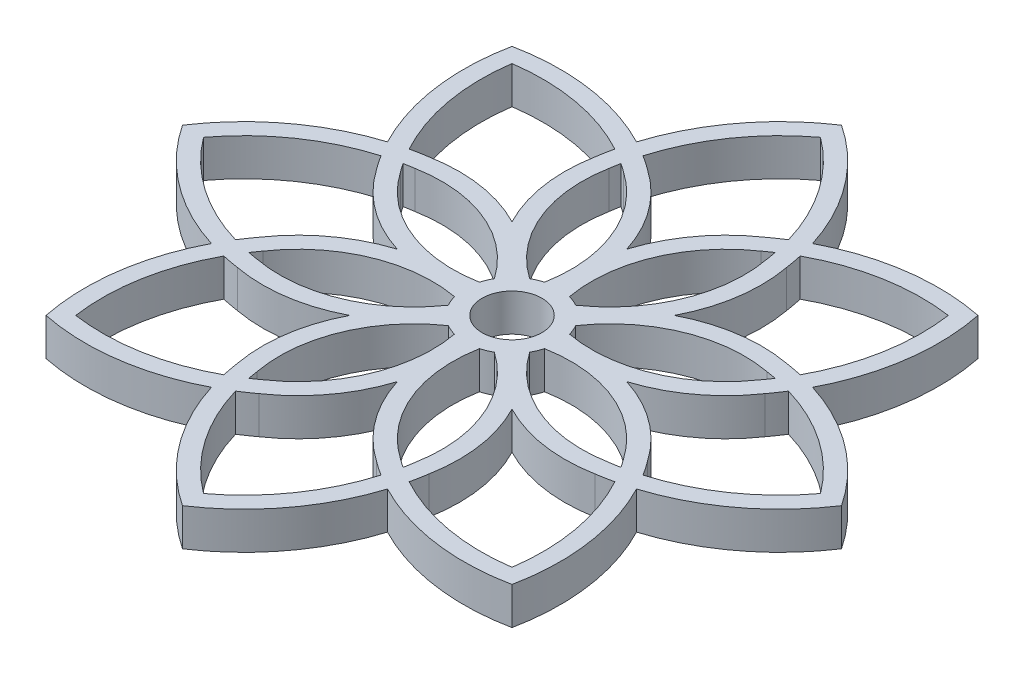
from build123d import *

# Parameters (mm, degrees)
SKETCH1_R           = 8
BOSS_EXTRUDE1_DEPTH = 10


with BuildPart() as part:
    # Sketch1 → Boss-Extrude1 (new body)
    with BuildSketch(Plane(origin=(0, 0, 0), x_dir=(1, 0, 0), z_dir=(0, 1, 0))):
        with BuildLine():
            ThreePointArc((132.061588533, 196.381566986), (114.390952091, 187.298124203), (100.771812534, 172.831633171))
            ThreePointArc((100.771812534, 172.831633171), (114.390952091, 158.365142138), (132.061588533, 149.281699355))
            ThreePointArc((132.061588533, 149.281699355), (125.989525665, 130.36370851), (126.588693639, 110.504168667))
            ThreePointArc((126.588693639, 110.504168667), (146.448233483, 109.905000692), (165.366224328, 115.97706356))
            ThreePointArc((165.366224328, 115.97706356), (174.449667111, 98.306427118), (188.916158144, 84.687287561))
            ThreePointArc((188.916158144, 84.687287561), (203.382649176, 98.306427118), (212.466091959, 115.97706356))
            ThreePointArc((212.466091959, 115.97706356), (231.384082804, 109.905000692), (251.243622648, 110.504168667))
            ThreePointArc((251.243622648, 110.504168667), (251.842790622, 130.36370851), (245.770727755, 149.281699355))
            ThreePointArc((245.770727755, 149.281699355), (263.441364197, 158.365142138), (277.060503754, 172.831633171))
            ThreePointArc((277.060503754, 172.831633171), (263.441364197, 187.298124203), (245.770727755, 196.381566986))
            ThreePointArc((245.770727755, 196.381566986), (251.842790622, 215.299557831), (251.243622648, 235.159097675))
            ThreePointArc((251.243622648, 235.159097675), (231.384082804, 235.758265649), (212.466091959, 229.686202782))
            ThreePointArc((212.466091959, 229.686202782), (203.382649176, 247.356839224), (188.916158144, 260.975978781))
            ThreePointArc((188.916158144, 260.975978781), (174.449667111, 247.356839224), (165.366224328, 229.686202782))
            ThreePointArc((165.366224328, 229.686202782), (146.448233483, 235.758265649), (126.588693639, 235.159097675))
            ThreePointArc((126.588693639, 235.159097675), (125.989525665, 215.299557831), (132.061588533, 196.381566986))
        make_face()
        with Locations(Location((188.916158144, 172.831633171, 0), (0, 0, 270))):
            Circle(SKETCH1_R, mode=Mode.SUBTRACT)
        with BuildLine():
            ThreePointArc((176.871760277, 169.487611636), (177.367663987, 168.048090266), (178.034902433, 166.679538067))
            ThreePointArc((178.034902433, 166.679538067), (162.154357713, 153.842018796), (141.841246677, 151.751296028))
            ThreePointArc((141.841246677, 151.751296028), (140.488899994, 151.965875923), (139.142429516, 152.214679723))
            ThreePointArc((139.142429516, 152.214679723), (139.918597067, 153.342708984), (140.723119678, 154.450693392))
            ThreePointArc((140.723119678, 154.450693392), (156.565022486, 167.335867706), (176.871760277, 169.487611636))
        make_face(mode=Mode.SUBTRACT)
        with BuildLine():
            ThreePointArc((195.068253247, 183.712888881), (207.905772518, 199.593433602), (209.996495287, 219.906544638))
            ThreePointArc((209.996495287, 219.906544638), (209.781915392, 221.25889132), (209.533111591, 222.605361798))
            ThreePointArc((209.533111591, 222.605361798), (208.40508233, 221.829194247), (207.297097922, 221.024671636))
            ThreePointArc((207.297097922, 221.024671636), (194.411923609, 205.182768829), (192.260179678, 184.876031038))
            ThreePointArc((192.260179678, 184.876031038), (193.699701048, 184.380127327), (195.068253247, 183.712888881))
        make_face(mode=Mode.SUBTRACT)
        with BuildLine():
            ThreePointArc((210.615618124, 194.531093151), (214.768049978, 207.268191438), (214.534766702, 220.66303903))
            ThreePointArc((214.534766702, 220.66303903), (214.159943464, 222.904578299), (213.698475154, 225.129895749))
            ThreePointArc((213.698475154, 225.129895749), (229.99211058, 230.876497518), (247.266731538, 231.182206565))
            ThreePointArc((247.266731538, 231.182206565), (246.961022491, 213.907585607), (241.214420722, 197.613950181))
            ThreePointArc((241.214420722, 197.613950181), (238.989103272, 198.075418491), (236.747564002, 198.450241729))
            ThreePointArc((236.747564002, 198.450241729), (223.352716411, 198.683525005), (210.615618124, 194.531093151))
        make_face(mode=Mode.SUBTRACT)
        with BuildLine():
            ThreePointArc((163.297549585, 220.66303903), (163.672372824, 222.904578299), (164.133841133, 225.129895749))
            ThreePointArc((164.133841133, 225.129895749), (147.840205707, 230.876497518), (130.565584749, 231.182206565))
            ThreePointArc((130.565584749, 231.182206565), (130.871293797, 213.907585607), (136.617895565, 197.613950181))
            ThreePointArc((136.617895565, 197.613950181), (138.843213016, 198.075418491), (141.084752285, 198.450241729))
            ThreePointArc((141.084752285, 198.450241729), (154.479599876, 198.683525005), (167.216698164, 194.531093151))
            ThreePointArc((167.216698164, 194.531093151), (163.06426631, 207.268191438), (163.297549585, 220.66303903))
        make_face(mode=Mode.SUBTRACT)
        with BuildLine():
            ThreePointArc((167.835821, 219.906544638), (168.050400896, 221.25889132), (168.299204696, 222.605361798))
            ThreePointArc((168.299204696, 222.605361798), (169.427233957, 221.829194247), (170.535218365, 221.024671636))
            ThreePointArc((170.535218365, 221.024671636), (183.420392678, 205.182768829), (185.572136609, 184.876031038))
            ThreePointArc((185.572136609, 184.876031038), (184.132615239, 184.380127327), (182.76406304, 183.712888881))
            ThreePointArc((182.76406304, 183.712888881), (169.926543769, 199.593433602), (167.835821, 219.906544638))
        make_face(mode=Mode.SUBTRACT)
        with BuildLine():
            ThreePointArc((188.916158144, 203.519303771), (194.986433993, 215.462005065), (204.622977744, 224.768636443))
            ThreePointArc((204.622977744, 224.768636443), (206.473025415, 226.088604007), (208.372869845, 227.335833696))
            ThreePointArc((208.372869845, 227.335833696), (200.914990825, 242.920634875), (188.916158144, 255.351805437))
            ThreePointArc((188.916158144, 255.351805437), (176.917325462, 242.920634875), (169.459446442, 227.335833696))
            ThreePointArc((169.459446442, 227.335833696), (171.359290872, 226.088604007), (173.209338544, 224.768636444))
            ThreePointArc((173.209338544, 224.768636444), (182.845882294, 215.462005065), (188.916158144, 203.519303771))
        make_face(mode=Mode.SUBTRACT)
        with BuildLine():
            ThreePointArc((237.109196609, 191.212572949), (237.91371922, 192.320557357), (238.689886771, 193.448586618))
            ThreePointArc((238.689886771, 193.448586618), (237.343416293, 193.697390419), (235.991069611, 193.911970314))
            ThreePointArc((235.991069611, 193.911970314), (215.677958575, 191.821247545), (199.797413854, 178.983728274))
            ThreePointArc((199.797413854, 178.983728274), (200.4646523, 177.615176075), (200.960556011, 176.175654705))
            ThreePointArc((200.960556011, 176.175654705), (221.267293802, 178.327398636), (237.109196609, 191.212572949))
        make_face(mode=Mode.SUBTRACT)
        with BuildLine():
            ThreePointArc((240.853161416, 188.538452771), (242.17312898, 190.388500442), (243.420358669, 192.288344873))
            ThreePointArc((243.420358669, 192.288344873), (259.005159848, 184.830465852), (271.43633041, 172.831633171))
            ThreePointArc((271.43633041, 172.831633171), (259.005159848, 160.832800489), (243.420358669, 153.374921469))
            ThreePointArc((243.420358669, 153.374921469), (242.17312898, 155.274765899), (240.853161416, 157.124813571))
            ThreePointArc((240.853161416, 157.124813571), (231.546530038, 166.761357321), (219.603828744, 172.831633171))
            ThreePointArc((219.603828744, 172.831633171), (231.546530038, 178.90190902), (240.853161416, 188.538452771))
        make_face(mode=Mode.SUBTRACT)
        with BuildLine():
            ThreePointArc((235.991069611, 151.751296028), (237.343416293, 151.965875923), (238.689886771, 152.214679723))
            ThreePointArc((238.689886771, 152.214679723), (237.91371922, 153.342708984), (237.109196609, 154.450693392))
            ThreePointArc((237.109196609, 154.450693392), (221.267293802, 167.335867706), (200.960556011, 169.487611636))
            ThreePointArc((200.960556011, 169.487611636), (200.4646523, 168.048090266), (199.797413854, 166.679538067))
            ThreePointArc((199.797413854, 166.679538067), (215.677958575, 153.842018796), (235.991069611, 151.751296028))
        make_face(mode=Mode.SUBTRACT)
        with BuildLine():
            ThreePointArc((236.747564002, 147.213024612), (238.989103272, 147.587847851), (241.214420722, 148.04931616))
            ThreePointArc((241.214420722, 148.04931616), (246.961022491, 131.755680735), (247.266731538, 114.481059776))
            ThreePointArc((247.266731538, 114.481059776), (229.99211058, 114.786768824), (213.698475154, 120.533370592))
            ThreePointArc((213.698475154, 120.533370592), (214.159943464, 122.758688043), (214.534766702, 125.000227312))
            ThreePointArc((214.534766702, 125.000227312), (214.768049978, 138.395074903), (210.615618124, 151.132173191))
            ThreePointArc((210.615618124, 151.132173191), (223.352716411, 146.979741337), (236.747564002, 147.213024612))
        make_face(mode=Mode.SUBTRACT)
        with BuildLine():
            ThreePointArc((207.297097922, 124.638594705), (208.40508233, 123.834072094), (209.533111591, 123.057904543))
            ThreePointArc((209.533111591, 123.057904543), (209.781915392, 124.404375022), (209.996495287, 125.756721704))
            ThreePointArc((209.996495287, 125.756721704), (207.905772518, 146.06983274), (195.068253247, 161.95037746))
            ThreePointArc((195.068253247, 161.95037746), (193.699701048, 161.283139014), (192.260179678, 160.787235304))
            ThreePointArc((192.260179678, 160.787235304), (194.411923609, 140.480497513), (207.297097922, 124.638594705))
        make_face(mode=Mode.SUBTRACT)
        with BuildLine():
            ThreePointArc((204.622977744, 120.894629898), (206.473025415, 119.574662334), (208.372869845, 118.327432646))
            ThreePointArc((208.372869845, 118.327432646), (200.914990825, 102.742631467), (188.916158144, 90.311460904))
            ThreePointArc((188.916158144, 90.311460904), (176.917325462, 102.742631467), (169.459446442, 118.327432646))
            ThreePointArc((169.459446442, 118.327432646), (171.359290872, 119.574662334), (173.209338544, 120.894629898))
            ThreePointArc((173.209338544, 120.894629898), (182.845882294, 130.201261277), (188.916158144, 142.143962571))
            ThreePointArc((188.916158144, 142.143962571), (194.986433993, 130.201261277), (204.622977744, 120.894629898))
        make_face(mode=Mode.SUBTRACT)
        with BuildLine():
            ThreePointArc((167.835821, 125.756721704), (168.050400896, 124.404375022), (168.299204696, 123.057904543))
            ThreePointArc((168.299204696, 123.057904543), (169.427233957, 123.834072094), (170.535218365, 124.638594705))
            ThreePointArc((170.535218365, 124.638594705), (183.420392678, 140.480497513), (185.572136609, 160.787235304))
            ThreePointArc((185.572136609, 160.787235304), (184.132615239, 161.283139014), (182.76406304, 161.95037746))
            ThreePointArc((182.76406304, 161.95037746), (169.926543769, 146.06983274), (167.835821, 125.756721704))
        make_face(mode=Mode.SUBTRACT)
        with BuildLine():
            ThreePointArc((163.297549585, 125.000227312), (163.672372824, 122.758688043), (164.133841133, 120.533370592))
            ThreePointArc((164.133841133, 120.533370592), (147.840205707, 114.786768824), (130.565584749, 114.481059776))
            ThreePointArc((130.565584749, 114.481059776), (130.871293797, 131.755680735), (136.617895565, 148.04931616))
            ThreePointArc((136.617895565, 148.04931616), (138.843213016, 147.587847851), (141.084752285, 147.213024612))
            ThreePointArc((141.084752285, 147.213024612), (154.479599876, 146.979741337), (167.216698164, 151.132173191))
            ThreePointArc((167.216698164, 151.132173191), (163.06426631, 138.395074903), (163.297549585, 125.000227312))
        make_face(mode=Mode.SUBTRACT)
        with BuildLine():
            ThreePointArc((136.979154871, 157.124813571), (135.659187307, 155.274765899), (134.411957619, 153.374921469))
            ThreePointArc((134.411957619, 153.374921469), (118.82715644, 160.832800489), (106.395985877, 172.831633171))
            ThreePointArc((106.395985877, 172.831633171), (118.82715644, 184.830465852), (134.411957619, 192.288344873))
            ThreePointArc((134.411957619, 192.288344873), (135.659187307, 190.388500442), (136.979154871, 188.538452771))
            ThreePointArc((136.979154871, 188.538452771), (146.28578625, 178.90190902), (158.228487544, 172.831633171))
            ThreePointArc((158.228487544, 172.831633171), (146.28578625, 166.761357321), (136.979154871, 157.124813571))
        make_face(mode=Mode.SUBTRACT)
        with BuildLine():
            ThreePointArc((141.841246677, 193.911970314), (140.488899994, 193.697390419), (139.142429516, 193.448586618))
            ThreePointArc((139.142429516, 193.448586618), (139.918597067, 192.320557357), (140.723119678, 191.212572949))
            ThreePointArc((140.723119678, 191.212572949), (156.565022486, 178.327398636), (176.871760277, 176.175654705))
            ThreePointArc((176.871760277, 176.175654705), (177.367663987, 177.615176075), (178.034902433, 178.983728274))
            ThreePointArc((178.034902433, 178.983728274), (162.154357713, 191.821247545), (141.841246677, 193.911970314))
        make_face(mode=Mode.SUBTRACT)
    extrude(amount=BOSS_EXTRUDE1_DEPTH)


solid = part.part
